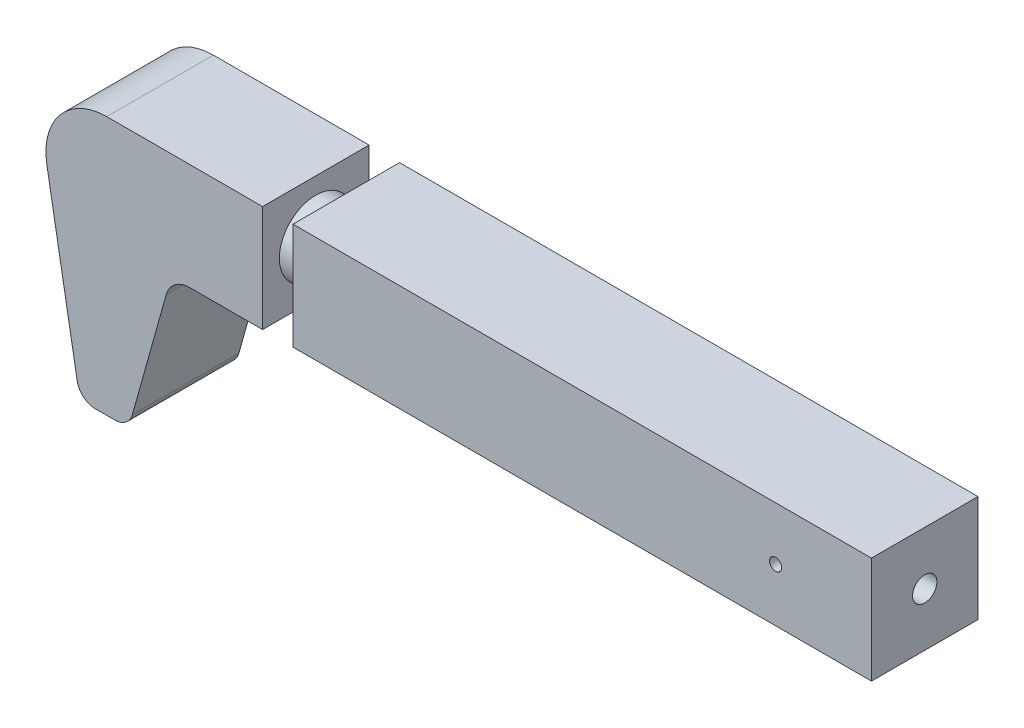
from build123d import *

# Parameters (mm, degrees)
BOSS_EXTRUDE4_START = 5
SKETCH2_W           = 17.5
SKETCH2_H           = 17.5
BOSS_EXTRUDE4_DEPTH = 95
SKETCH3_R           = 2
CUT_EXTRUDE1_DEPTH  = 50
SKETCH4_R           = 1
CUT_EXTRUDE2_DEPTH  = 50
SKETCH6_R           = 6
BOSS_EXTRUDE6_DEPTH = 5
BOSS_EXTRUDE8_DEPTH = 17.5


with BuildPart() as part:
    # Sketch2 → Boss-Extrude4 (new body)
    with BuildSketch(Plane(origin=(0, 0, 0), x_dir=(0, 0, -1), z_dir=(1, 0, 0)).offset(BOSS_EXTRUDE4_START)):
        with Locations((-8.75, 8.75)):
            Rectangle(SKETCH2_W, SKETCH2_H)
    extrude(amount=BOSS_EXTRUDE4_DEPTH)

    # Sketch3 → Cut-Extrude1 (cut)
    with BuildSketch(Plane(origin=(100, 0, 0), x_dir=(0, 0, -1), z_dir=(1, 0, 0))):
        with Locations(Location((-8.75, 8.75, 0), (0, 0, 90))):
            Circle(SKETCH3_R)
    extrude(amount=-CUT_EXTRUDE1_DEPTH, mode=Mode.SUBTRACT)

    # Sketch4 → Cut-Extrude2 (cut)
    with BuildSketch(Plane(origin=(0, 0, 0), x_dir=(-1, 0, 0), z_dir=(0, 0, -1))):
        with Locations((-84.25, 8.75)):
            Circle(SKETCH4_R)
    extrude(amount=-CUT_EXTRUDE2_DEPTH, mode=Mode.SUBTRACT)

    # Sketch6 → Boss-Extrude6 (add)
    with BuildSketch(Plane.ZY.offset(-5)):
        with Locations((8.75, 8.75)):
            Circle(SKETCH6_R)
    extrude(amount=BOSS_EXTRUDE6_DEPTH)

    # Sketch1 → Boss-Extrude8 (add)
    with BuildSketch(Plane.XY):
        with BuildLine():
            Line((0, 17.5), (-25.582464074, 17.5))
            ThreePointArc((-25.582464074, 17.5), (-33.242908505, 13.927876097), (-35.430541604, 5.763518223))
            Line((-35.430541604, 5.763518223), (-30.443227685, -22.520944533))
            ThreePointArc((-30.443227685, -22.520944533), (-29.417167255, -24.298133329), (-27.488804426, -25))
            Line((-27.488804426, -25), (-24.280949674, -25))
            ThreePointArc((-24.280949674, -25), (-22.468303976, -24.390463464), (-21.392240798, -22.809543714))
            Line((-21.392240798, -22.809543714), (-15.818483363, -2.920608381))
            ThreePointArc((-15.818483363, -2.920608381), (-14.383732459, -0.812715382), (-11.966871527, 0))
            Line((-11.966871527, 0), (0, 0))
            Line((0, 0), (0, 17.5))
        make_face()
    extrude(amount=BOSS_EXTRUDE8_DEPTH)


solid = part.part
